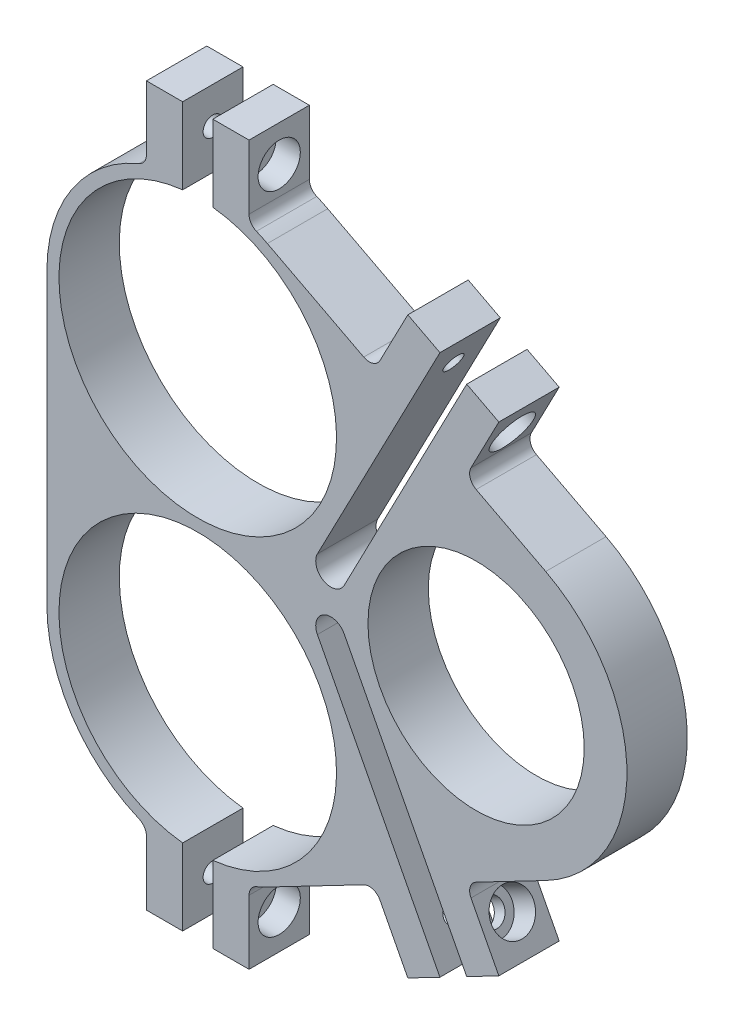
from build123d import *

# Parameters (mm, degrees)
SKETCH1_R                                        = 28.448
EXTRUDE1_DEPTH                                   = 7.9375
CBORE_FOR_1_4_SOCKET_HEAD_CAP_SCREW1_D           = 6.7564
CBORE_FOR_1_4_SOCKET_HEAD_CAP_SCREW1_DEPTH       = 9.525
CBORE_FOR_1_4_SOCKET_HEAD_CAP_SCREW1_CBORE_D     = 11.1125
CBORE_FOR_1_4_SOCKET_HEAD_CAP_SCREW1_CBORE_DEPTH = 6.35
F_1_4_20_TAPPED_HOLE1_D                          = 5.1054
CBORE_FOR_1_4_SOCKET_HEAD_CAP_SCREW3_D           = 6.7564
CBORE_FOR_1_4_SOCKET_HEAD_CAP_SCREW3_DEPTH       = 9.525
CBORE_FOR_1_4_SOCKET_HEAD_CAP_SCREW3_CBORE_D     = 11.1125
CBORE_FOR_1_4_SOCKET_HEAD_CAP_SCREW3_CBORE_DEPTH = 6.35
F_1_4_20_TAPPED_HOLE4_D                          = 5.1054
CBORE_FOR_1_4_SOCKET_HEAD_CAP_SCREW4_D           = 6.7564
CBORE_FOR_1_4_SOCKET_HEAD_CAP_SCREW4_DEPTH       = 9.525
CBORE_FOR_1_4_SOCKET_HEAD_CAP_SCREW4_CBORE_D     = 11.1125
CBORE_FOR_1_4_SOCKET_HEAD_CAP_SCREW4_CBORE_DEPTH = 6.35
F_1_4_20_TAPPED_HOLE5_D                          = 5.1054
F_1_4_20_TAPPED_HOLE5_DEPTH                      = 9.525
CBORE_FOR_1_4_SOCKET_HEAD_CAP_SCREW5_D           = 6.7564
CBORE_FOR_1_4_SOCKET_HEAD_CAP_SCREW5_DEPTH       = 9.525
CBORE_FOR_1_4_SOCKET_HEAD_CAP_SCREW5_CBORE_D     = 11.1125
CBORE_FOR_1_4_SOCKET_HEAD_CAP_SCREW5_CBORE_DEPTH = 6.35
F_1_4_20_TAPPED_HOLE6_D                          = 5.1054
F_1_4_20_TAPPED_HOLE6_DEPTH                      = 9.525
FILLET1_R                                        = 3.175


with BuildPart() as part:
    # Sketch1 → Extrude1 (new, symmetric)
    with BuildSketch(Plane.XY):
        with BuildLine():
            Line((-39.6875, 76.2), (-39.6875, 0))
            ThreePointArc((-39.6875, 0), (-32.485618813, -22.798733003), (-13.49375, -37.323134477))
            Line((-13.49375, -37.323134477), (-13.49375, -56.373134477))
            Line((-13.49375, -56.373134477), (-3.96875, -56.373134477))
            Line((-3.96875, -56.373134477), (-3.96875, -36.296166184))
            ThreePointArc((-3.96875, -36.296166184), (0, 36.5125), (3.96875, -36.296166184))
            Line((3.96875, -36.296166184), (3.96875, -56.373134477))
            Line((3.96875, -56.373134477), (13.49375, -56.373134477))
            Line((13.49375, -56.373134477), (13.49375, -37.323134477))
            ThreePointArc((13.49375, -37.323134477), (15.940663019, -36.345466275), (18.317307692, -35.207582921))
            Line((18.317307692, -35.207582921), (46.483374029, -20.553736767))
            Line((46.483374029, -20.553736767), (55.275681722, -37.45337657))
            Line((55.275681722, -37.45337657), (63.725501623, -33.057222723))
            Line((63.725501623, -33.057222723), (54.93319393, -16.157582921))
            Line((54.93319393, -16.157582921), (31.487040084, 28.908123218))
            ThreePointArc((31.487040084, 28.908123218), (33.176067607, 34.260612279), (38.528556668, 32.571584756))
            Line((38.528556668, 32.571584756), (61.974710515, -12.494121383))
            Line((61.974710515, -12.494121383), (70.767018207, -29.393761185))
            Line((70.767018207, -29.393761185), (79.216838108, -24.997607339))
            Line((79.216838108, -24.997607339), (70.424530416, -8.097967537))
            Line((70.424530416, -8.097967537), (91.549080168, 2.892417079))
            ThreePointArc((91.549080168, 2.892417079), (112.919272476, 38.1), (91.549080168, 73.307582921))
            Line((91.549080168, 73.307582921), (70.424530416, 84.297967537))
            Line((70.424530416, 84.297967537), (79.216838108, 101.197607339))
            Line((79.216838108, 101.197607339), (70.767018207, 105.593761185))
            Line((70.767018207, 105.593761185), (61.974710515, 88.694121383))
            Line((61.974710515, 88.694121383), (38.528556668, 43.628415244))
            ThreePointArc((38.528556668, 43.628415244), (33.176067607, 41.939387721), (31.487040084, 47.291876782))
            Line((31.487040084, 47.291876782), (54.93319393, 92.357582921))
            Line((54.93319393, 92.357582921), (63.725501623, 109.257222723))
            Line((63.725501623, 109.257222723), (55.275681722, 113.65337657))
            Line((55.275681722, 113.65337657), (46.483374029, 96.753736767))
            Line((46.483374029, 96.753736767), (18.317307692, 111.407582921))
            ThreePointArc((18.317307692, 111.407582921), (15.940663019, 112.545466275), (13.49375, 113.523134477))
            Line((13.49375, 113.523134477), (13.49375, 132.573134477))
            Line((13.49375, 132.573134477), (3.96875, 132.573134477))
            Line((3.96875, 132.573134477), (3.96875, 112.496166184))
            ThreePointArc((3.96875, 112.496166184), (0, 39.6875), (-3.96875, 112.496166184))
            Line((-3.96875, 112.496166184), (-3.96875, 132.573134477))
            Line((-3.96875, 132.573134477), (-13.49375, 132.573134477))
            Line((-13.49375, 132.573134477), (-13.49375, 113.523134477))
            ThreePointArc((-13.49375, 113.523134477), (-32.485618813, 98.998733003), (-39.6875, 76.2))
        make_face()
        with Locations((73.231772476, 38.1)):
            Circle(SKETCH1_R, mode=Mode.SUBTRACT)
    extrude(amount=EXTRUDE1_DEPTH, both=True)

    # CBORE for 1/4 Socket Head Cap Screw1
    with Locations(Plane(origin=(13.49375, 0, 0), x_dir=(0, 0, -1), z_dir=(1, 0, 0))):
        with Locations((0, 123.048134477)):
            CounterBoreHole(CBORE_FOR_1_4_SOCKET_HEAD_CAP_SCREW1_D / 2, CBORE_FOR_1_4_SOCKET_HEAD_CAP_SCREW1_CBORE_D / 2, CBORE_FOR_1_4_SOCKET_HEAD_CAP_SCREW1_CBORE_DEPTH, depth=CBORE_FOR_1_4_SOCKET_HEAD_CAP_SCREW1_DEPTH)

    # 1/4-20 Tapped Hole1 (through all)
    with Locations(Plane(origin=(-3.96875, 0, 0), x_dir=(0, 0, -1), z_dir=(1, 0, 0))):
        with Locations((0, 123.048134477)):
            Hole(F_1_4_20_TAPPED_HOLE1_D / 2)

    # CBORE for 1/4 Socket Head Cap Screw3
    with Locations(Plane(origin=(13.49375, 0, 0), x_dir=(0, 0, -1), z_dir=(1, 0, 0))):
        with Locations((0, -46.848134477)):
            CounterBoreHole(CBORE_FOR_1_4_SOCKET_HEAD_CAP_SCREW3_D / 2, CBORE_FOR_1_4_SOCKET_HEAD_CAP_SCREW3_CBORE_D / 2, CBORE_FOR_1_4_SOCKET_HEAD_CAP_SCREW3_CBORE_DEPTH, depth=CBORE_FOR_1_4_SOCKET_HEAD_CAP_SCREW3_DEPTH)

    # 1/4-20 Tapped Hole4 (through all)
    with Locations(Plane(origin=(-3.96875, 0, 0), x_dir=(0, 0, -1), z_dir=(1, 0, 0))):
        with Locations((0, -46.848134477)):
            Hole(F_1_4_20_TAPPED_HOLE4_D / 2)

    # CBORE for 1/4 Socket Head Cap Screw4
    with Locations(Plane(origin=(20.907887704, -10.877662722, 0), x_dir=(0, 0, -1), z_dir=(0.8871201995900625, -0.46153846153845923, 0))):
        with Locations((0, 116.811059209)):
            CounterBoreHole(CBORE_FOR_1_4_SOCKET_HEAD_CAP_SCREW4_D / 2, CBORE_FOR_1_4_SOCKET_HEAD_CAP_SCREW4_CBORE_D / 2, CBORE_FOR_1_4_SOCKET_HEAD_CAP_SCREW4_CBORE_DEPTH, depth=CBORE_FOR_1_4_SOCKET_HEAD_CAP_SCREW4_DEPTH)

    # 1/4-20 Tapped Hole5
    with Locations(Plane(origin=(5.416551219, -2.818047337, 0), x_dir=(0, 0, -1), z_dir=(0.8871201995900618, -0.4615384615384606, 0))):
        with Locations((0, 116.811059209)):
            Hole(F_1_4_20_TAPPED_HOLE5_D / 2, depth=F_1_4_20_TAPPED_HOLE5_DEPTH)

    # CBORE for 1/4 Socket Head Cap Screw5
    with Locations(Plane(origin=(52.107222723, 27.109615385, 0), x_dir=(0, 0, -1), z_dir=(0.8871201995900624, 0.46153846153845934, 0))):
        with Locations((0, -49.2125)):
            CounterBoreHole(CBORE_FOR_1_4_SOCKET_HEAD_CAP_SCREW5_D / 2, CBORE_FOR_1_4_SOCKET_HEAD_CAP_SCREW5_CBORE_D / 2, CBORE_FOR_1_4_SOCKET_HEAD_CAP_SCREW5_CBORE_DEPTH, depth=CBORE_FOR_1_4_SOCKET_HEAD_CAP_SCREW5_DEPTH)

    # 1/4-20 Tapped Hole6
    with Locations(Plane(origin=(36.615886238, 19.05, 0), x_dir=(0, 0, -1), z_dir=(0.8871201995900614, 0.4615384615384613, 0))):
        with Locations((0, -49.2125)):
            Hole(F_1_4_20_TAPPED_HOLE6_D / 2, depth=F_1_4_20_TAPPED_HOLE6_DEPTH)

    # Fillet1
    fillet1_edges = [part.edges().sort_by_distance(p)[0] for p in [
        (-13.49375, 113.523134477, 0),
        (13.49375, 113.523134477, 0),
        (46.483374029, 96.753736767, 0),
        (70.424530416, 84.297967537, 0),
        (70.424530416, -8.097967537, 0),
        (46.483374029, -20.553736767, 0),
        (13.49375, -37.323134477, 0),
        (-13.49375, -37.323134477, 0),
    ]]
    fillet(fillet1_edges, radius=FILLET1_R)


solid = part.part
